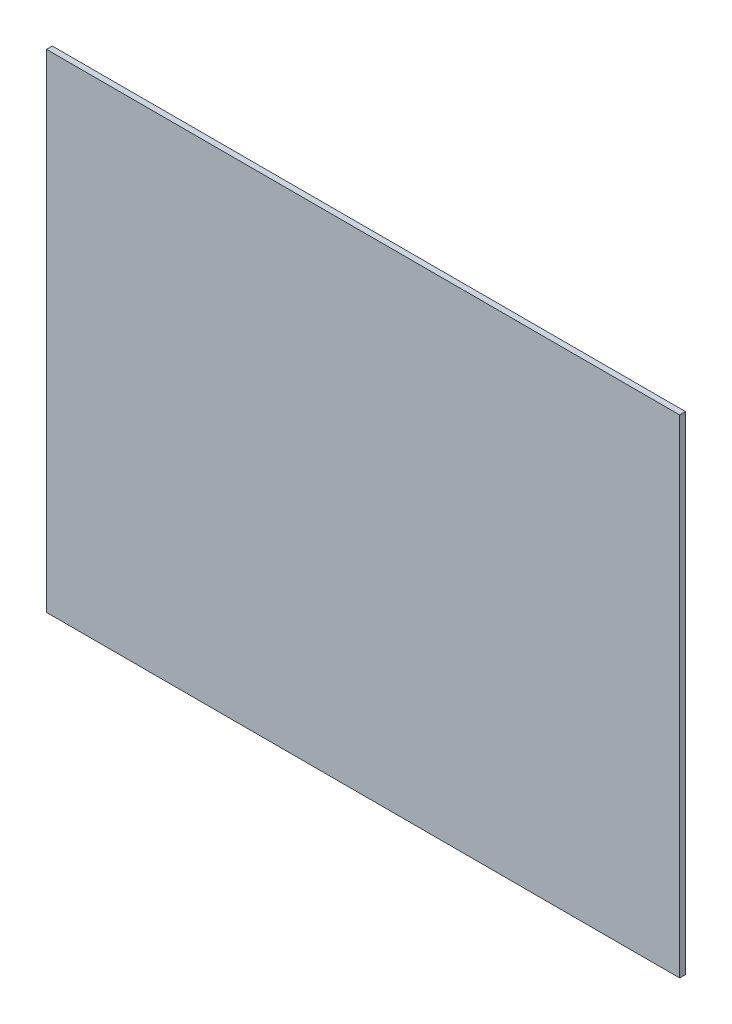
from build123d import *

# Parameters (mm, degrees)
SKETCH1_W           = 435
SKETCH1_H           = 335
BOSS_EXTRUDE1_DEPTH = 4


with BuildPart() as part:
    # Sketch1 → Boss-Extrude1 (new body)
    with BuildSketch(Plane.XY):
        Rectangle(SKETCH1_W, SKETCH1_H)
    extrude(amount=BOSS_EXTRUDE1_DEPTH)


solid = part.part
